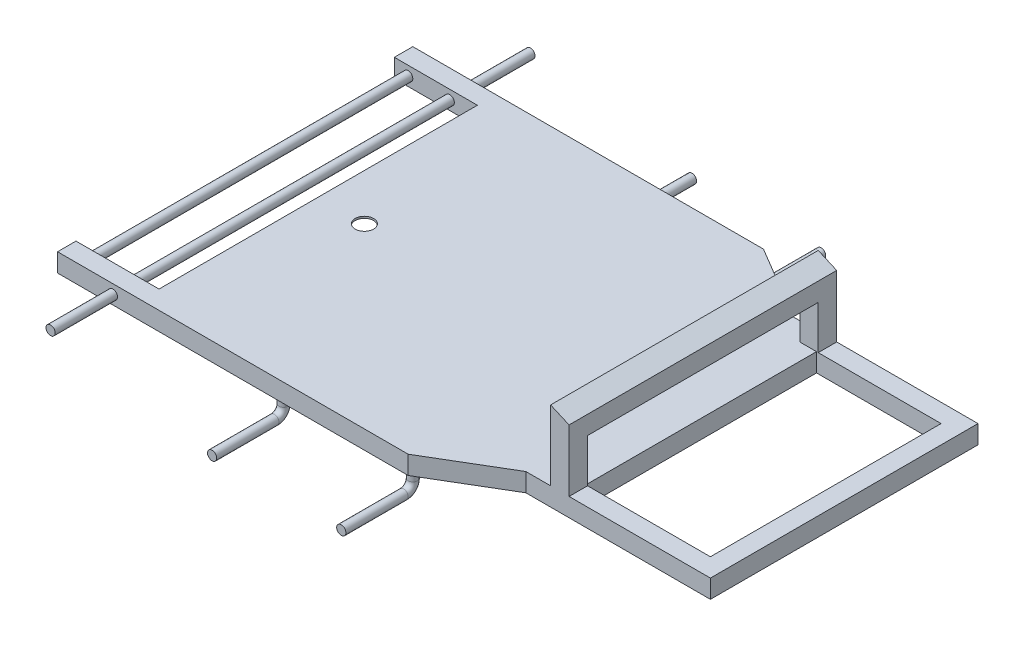
from build123d import *

# Parameters (mm, degrees)
BOSS_EXTRUDE1_DEPTH = 10
SKETCH2_R           = 5
SKETCH2_W           = 20
SKETCH2_H           = 20
BOSS_EXTRUDE2_DEPTH = 175
SKETCH3_R           = 5
BOSS_EXTRUDE3_DEPTH = 260
SKETCH4_R           = 5
SKETCH5_W           = 30
SKETCH5_H           = 20
CUT_EXTRUDE1_DEPTH  = 20
BOSS_EXTRUDE4_DEPTH = 2
SKETCH7_R           = 10
CUT_EXTRUDE2_DEPTH  = 30
SKETCH8_W           = 20
SKETCH8_H           = 290
BOSS_EXTRUDE5_DEPTH = 75.92
CUT_EXTRUDE3_DEPTH  = 290
SKETCH10_W          = 250
SKETCH10_H          = 47.150724805
CUT_EXTRUDE4_DEPTH  = 20


with BuildPart() as part:
    # Sketch1 → Boss-Extrude1 (new, symmetric)
    with BuildSketch(Plane(origin=(0, 0, 0), x_dir=(1, 0, 0), z_dir=(0, 1, 0))):
        Polygon((-330, 192.5), (50, 192.5), (130, 145), (330, 145), (330, 125), (330, -125), (330, -145), (130, -145), (50, -192.5), (-330, -192.5), (-330, -172.5), (44.50990723, -172.5), (124.50990723, -125), (310, -125), (310, 125), (124.50990723, 125), (44.50990723, 172.5), (-330, 172.5), align=None)
    extrude(amount=BOSS_EXTRUDE1_DEPTH, both=True)

    # Sketch2 → Boss-Extrude2 (add, symmetric)
    with BuildSketch(Plane.XY):
        with Locations(Location((-315, 0, 0), (0, 0, 180))):
            Circle(SKETCH2_R)
        with Locations((-230, 0)):
            Rectangle(SKETCH2_W, SKETCH2_H)
        with Locations((165, 0)):
            Rectangle(SKETCH2_W, SKETCH2_H)
    extrude(amount=BOSS_EXTRUDE2_DEPTH, both=True)

    # Sketch3 → Boss-Extrude3 (add, symmetric)
    with BuildSketch(Plane.XY):
        with Locations((-270, 0)):
            Circle(SKETCH3_R)
    extrude(amount=BOSS_EXTRUDE3_DEPTH, both=True)

    # Sweep1: sweep along a curve in space
    with BuildLine() as sweep1_path:
        Line((-95, -10, 182.5), (-95, -20, 182.5))
        ThreePointArc((-95, -20, 182.5), (-95, -27.071067812, 185.428932188), (-95, -30, 192.5))
        Line((-95, -30, 192.5), (-95, -30, 260))
    # Sketch4 → Sweep1 (sweep)
    with BuildSketch(Plane.XZ.offset(10)):
        with Locations((-95, 182.5)):
            Circle(SKETCH4_R)
        with Locations((45, 182.5)):
            Circle(SKETCH4_R)
    sweep1 = sweep(path=sweep1_path.line)

    # Mirror1: Sweep1 across plane
    add(sweep1.mirror(Plane.XY))

    # Sketch5 → Cut-Extrude1 (cut)
    with BuildSketch(Plane(origin=(175, 0, 0), x_dir=(0, 0, -1), z_dir=(1, 0, 0))):
        with Locations((-160, 0)):
            Rectangle(SKETCH5_W, SKETCH5_H)
        with Locations((160, 0)):
            Rectangle(SKETCH5_W, SKETCH5_H)
    extrude(amount=-CUT_EXTRUDE1_DEPTH, mode=Mode.SUBTRACT)

    # Sketch6 → Boss-Extrude4 (add)
    with BuildSketch(Plane(origin=(0, 10, 0), x_dir=(1, 0, 0), z_dir=(0, 1, 0))):
        Polygon((-220, -172.5), (-220, 172.5), (44.50990723, 172.5), (124.50990723, 125), (155, 125), (155, -125), (124.50990723, -125), (44.50990723, -172.5), align=None)
    extrude(amount=-BOSS_EXTRUDE4_DEPTH)

    # Sketch7 → Cut-Extrude2 (cut)
    with BuildSketch(Plane(origin=(0, 10, 0), x_dir=(1, 0, 0), z_dir=(0, 1, 0))):
        with Locations(Location((-190, 0, 0), (0, 0, 270))):
            Circle(SKETCH7_R)
    extrude(amount=-CUT_EXTRUDE2_DEPTH, mode=Mode.SUBTRACT)

    # Sketch8 → Boss-Extrude5 (add)
    with BuildSketch(Plane(origin=(0, 10, 0), x_dir=(1, 0, 0), z_dir=(0, 1, 0))):
        with Locations((166.85, 0)):
            Rectangle(SKETCH8_W, SKETCH8_H)
    extrude(amount=BOSS_EXTRUDE5_DEPTH)

    # Sketch9 → Cut-Extrude3 (cut)
    with BuildSketch(Plane.XY.offset(145)):
        Polygon((156.85, 85.92), (330, 10), (176.85, 85.92), align=None)
    extrude(amount=-CUT_EXTRUDE3_DEPTH, mode=Mode.SUBTRACT)

    # Sketch10 → Cut-Extrude4 (cut)
    with BuildSketch(Plane(origin=(176.85, 0, 0), x_dir=(0, 0, -1), z_dir=(1, 0, 0))):
        with Locations((0, 33.575362403)):
            Rectangle(SKETCH10_W, SKETCH10_H)
    extrude(amount=-CUT_EXTRUDE4_DEPTH, mode=Mode.SUBTRACT)


solid = part.part
